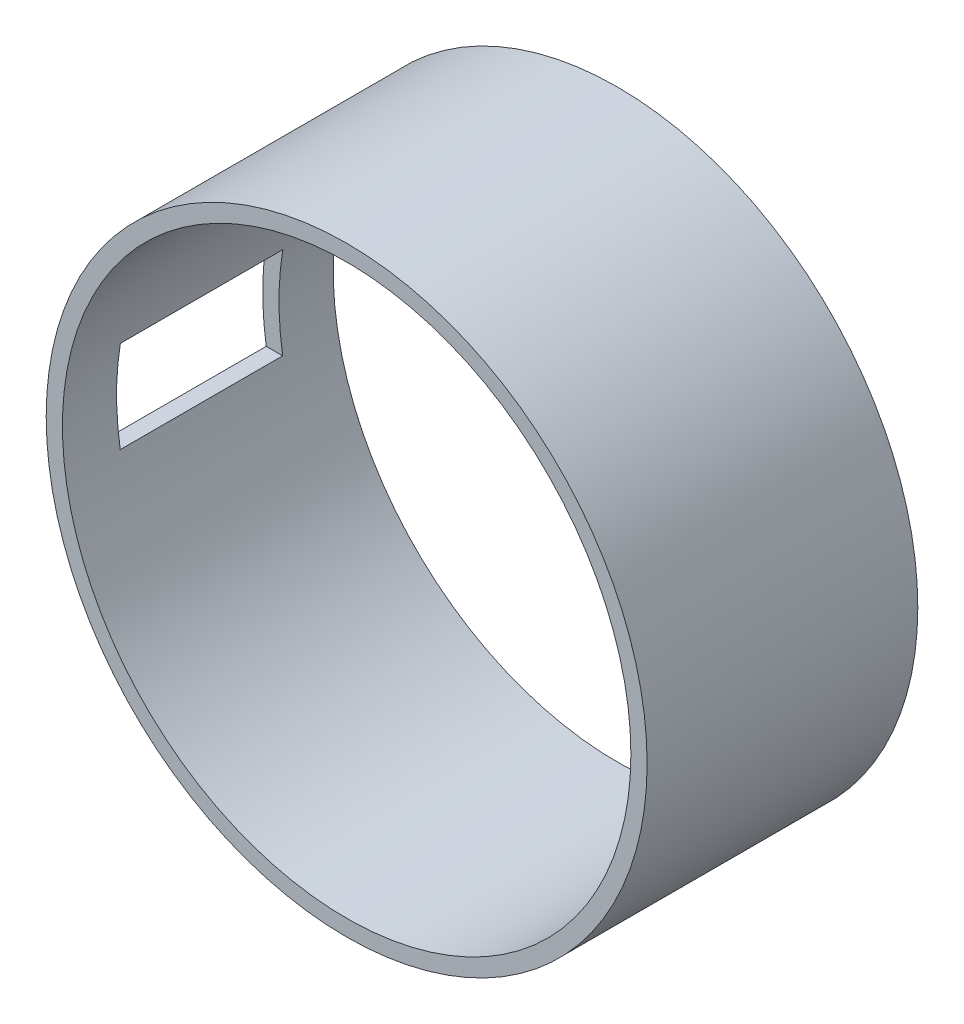
from build123d import *

# Parameters (mm, degrees)
SKETCH_1_R          = 11.1
SKETCH_1_R_2        = 10.5
EXTRUDE_1_DEPTH     = 10
SKETCH_3_W          = 6
SKETCH_3_H          = 3.4
CUT_EXTRUDE_1_DEPTH = 1.5


with BuildPart() as part:
    # 草图1 → 凸台-拉伸1 (new body)
    with BuildSketch(Plane.XY):
        Circle(SKETCH_1_R)
        Circle(SKETCH_1_R_2, mode=Mode.SUBTRACT)
    extrude(amount=EXTRUDE_1_DEPTH)

    # 草图3 → 切除-拉伸1 (cut)
    with BuildSketch(Plane.ZY.offset(11.1)):
        with Locations((5, 0.014841624)):
            Rectangle(SKETCH_3_W, SKETCH_3_H)
    extrude(amount=-CUT_EXTRUDE_1_DEPTH, mode=Mode.SUBTRACT)


solid = part.part
